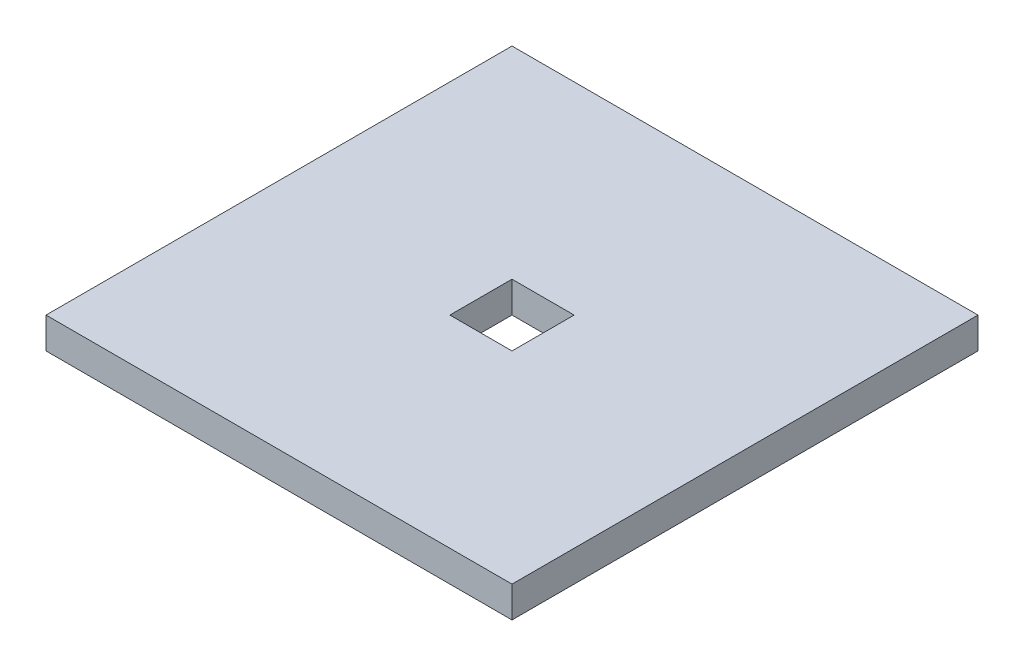
from build123d import *

# Parameters (mm, degrees)
SKETCH1_W           = 1500
SKETCH1_H           = 1500
SKETCH1_W_2         = 200
SKETCH1_H_2         = 200
BOSS_EXTRUDE1_DEPTH = 100


with BuildPart() as part:
    # Sketch1 → Boss-Extrude1 (new body)
    with BuildSketch(Plane(origin=(0, 0, 0), x_dir=(1, 0, 0), z_dir=(0, 1, 0))):
        with Locations((750, 750)):
            Rectangle(SKETCH1_W, SKETCH1_H)
        with Locations((750, 750)):
            Rectangle(SKETCH1_W_2, SKETCH1_H_2, mode=Mode.SUBTRACT)
    extrude(amount=BOSS_EXTRUDE1_DEPTH)


solid = part.part
